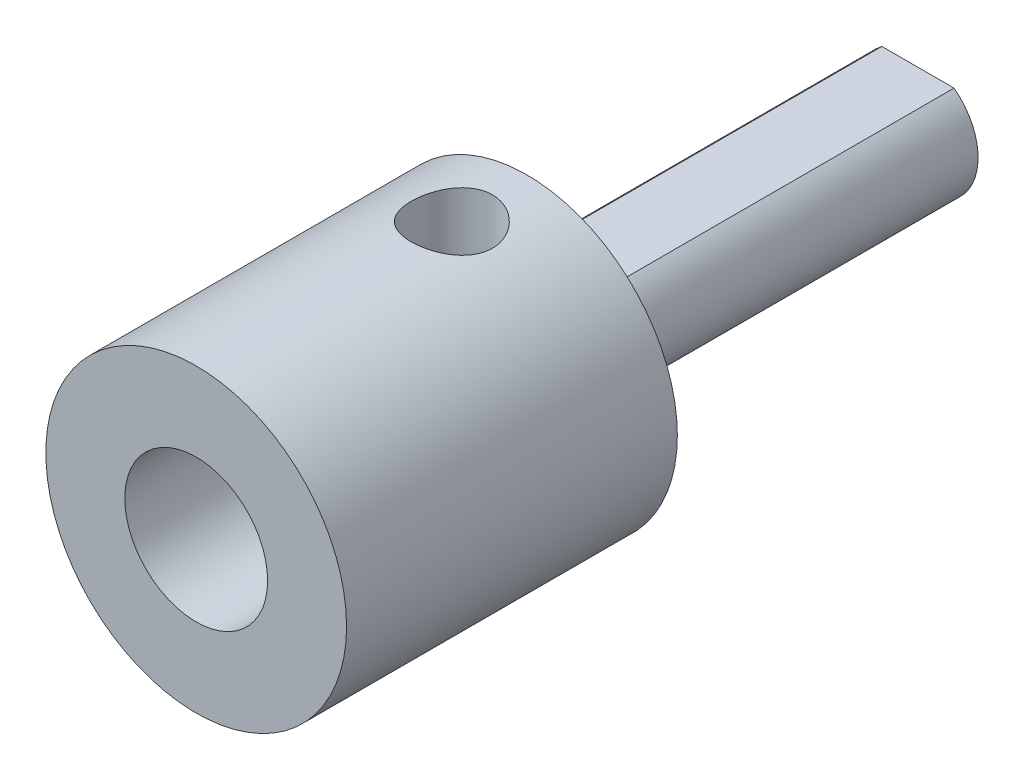
from build123d import *

# Parameters (mm, degrees)
SKETCH1_R             = 5
BOSS_EXTRUDE1_DEPTH   = 11
SKETCH2_R             = 2.375
CUT_EXTRUDE1_DEPTH    = 4
BOSS_EXTRUDE2_DEPTH   = 13
F_6_32_TAPPED_HOLE2_D = 2.7051


with BuildPart() as part:
    # Sketch1 → Boss-Extrude1 (new body)
    with BuildSketch(Plane.XY):
        Circle(SKETCH1_R)
    extrude(amount=BOSS_EXTRUDE1_DEPTH)

    # Sketch2 → Cut-Extrude1 (cut)
    with BuildSketch(Plane.XY.offset(11)):
        Circle(SKETCH2_R)
    extrude(amount=-CUT_EXTRUDE1_DEPTH, mode=Mode.SUBTRACT)

    # Sketch3 → Boss-Extrude2 (add)
    with BuildSketch(Plane(origin=(0, 0, 0), x_dir=(-1, 0, 0), z_dir=(0, 0, -1))):
        with BuildLine():
            Line((1.2, 1.6), (-1.2, 1.6))
            ThreePointArc((-1.2, 1.6), (-0.894427191, -1.788854382), (2, 0))
            ThreePointArc((2, 0), (1.788854382, 0.894427191), (1.2, 1.6))
        make_face()
    extrude(amount=BOSS_EXTRUDE2_DEPTH)

    # #6-32 Tapped Hole2 (through all)
    with Locations(Plane(origin=(0, 5, 0), x_dir=(1, 0, 0), z_dir=(0, 1, 0))):
        with Locations((0, -2.5)):
            Hole(F_6_32_TAPPED_HOLE2_D / 2)


solid = part.part
